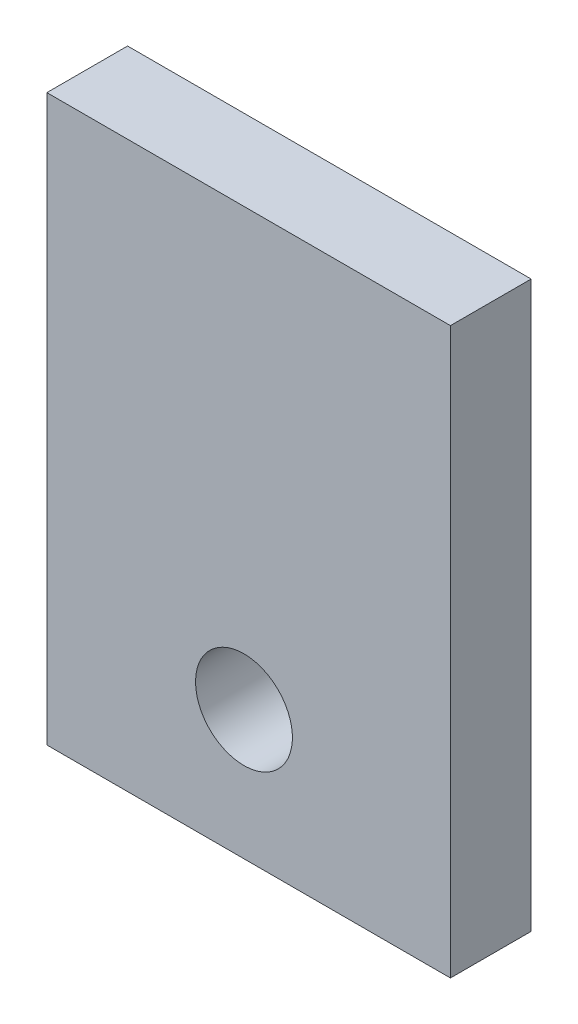
from build123d import *

# Parameters (mm, degrees)
SKIZZE1_W                            = 12
SKIZZE1_H                            = 10
HALTERUNGSSOCKEL_DEPTH               = 2
SKIZZE2_W                            = 25
SKIZZE2_H                            = 35
AUFSATZ_LINEAR_AUSTRAGEN2_DEPTH      = 5
SCHNITT_LINEAR_AUSTRAGEN1_DEPTH      = 32.533266888
SCHNITT_LINEAR_AUSTRAGEN1_DEPTH_BACK = 32.533266888
SKIZZE3_R                            = 3


with BuildPart() as part:
    # Skizze1 → Halterungssockel (new body)
    with BuildSketch(Plane.XY):
        with Locations((6, -5)):
            Rectangle(SKIZZE1_W, SKIZZE1_H)
    extrude(amount=HALTERUNGSSOCKEL_DEPTH)

    # Skizze2 → Aufsatz-Linear austragen2 (add)
    with BuildSketch(Plane.XY.offset(2)):
        with Locations((5.39823792, -7.5)):
            Rectangle(SKIZZE2_W, SKIZZE2_H)
    extrude(amount=AUFSATZ_LINEAR_AUSTRAGEN2_DEPTH)

    # Skizze3 → Schnitt-Linear austragen1 (cut, two sides: drawn at the far end of the back side and taken through both)
    with BuildSketch(Plane(origin=(0, 0, 0), x_dir=(-1, 0, 0), z_dir=(0, 0, -1)).offset(-SCHNITT_LINEAR_AUSTRAGEN1_DEPTH_BACK)):
        with Locations((-5.108390275, -17)):
            Circle(SKIZZE3_R)
    extrude(amount=SCHNITT_LINEAR_AUSTRAGEN1_DEPTH + SCHNITT_LINEAR_AUSTRAGEN1_DEPTH_BACK, mode=Mode.SUBTRACT)


solid = part.part
